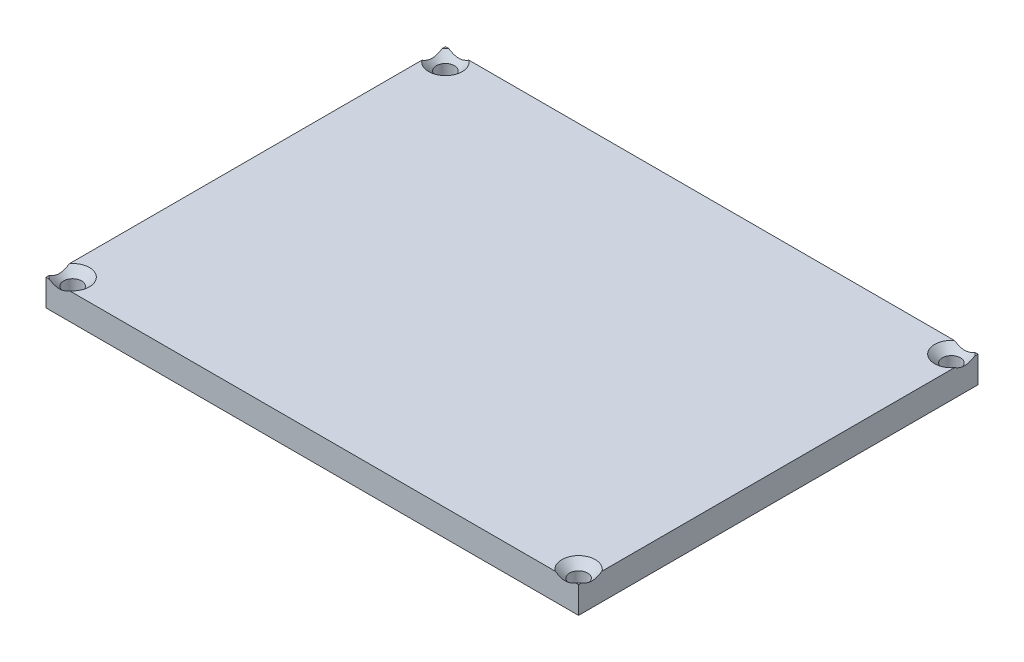
from build123d import *

# Parameters (mm, degrees)
SALIENTE_EXTRUIR1_DEPTH                     = 5
AVELLANADO_PARA_TORNILLO_CON_CABEZA_3_COUNT = 2
AVELLANADO_PARA_TORNILLO_CON_CABEZA_3_PITCH = 70
AVELLANADO_PARA_TORNILLO_CON_CABEZA_4_COUNT = 2
AVELLANADO_PARA_TORNILLO_CON_CABEZA_4_PITCH = 118.00423721205946
AVELLANADO_PARA_TORNILLO_CON_CABEZA_5_COUNT = 2
AVELLANADO_PARA_TORNILLO_CON_CABEZA_5_PITCH = 95
AVELLANADO_PARA_TORNILLO_CON_CABEZA_6_COUNT = 2
AVELLANADO_PARA_TORNILLO_CON_CABEZA_6_PITCH = 69.99999670760137
AVELLANADO_PARA_TORNILLO_CON_CABEZA_7_COUNT = 2
AVELLANADO_PARA_TORNILLO_CON_CABEZA_7_PITCH = 118.00424590243654
AVELLANADO_PARA_TORNILLO_CON_CABEZA_8_COUNT = 2
AVELLANADO_PARA_TORNILLO_CON_CABEZA_8_PITCH = 95.00001009358513


with BuildPart() as part:
    # Croquis1 → Saliente-Extruir1 (new body)
    with BuildSketch(Plane(origin=(0, 0, 0), x_dir=(1, 0, 0), z_dir=(0, 1, 0))):
        Polygon((-67.58389261744966, 18.71364653243848), (32.41610738255034, 18.71364653243848), (32.41610738255035, -56.28635346756151), (-67.58389261744965, -56.28635346756151), align=None)
    extrude(amount=SALIENTE_EXTRUIR1_DEPTH)

    # Croquis3 → Avellanado para tornillo con cabeza plana avellanada de M31 (revolve, cut)
    with BuildSketch(Plane(origin=(-65.08389261744965, 5, 53.78635346756151), x_dir=(0, 0, 1), z_dir=(1, 0, 0))):
        Polygon((0, 0), (-1.22e-15, 5.000000000000001), (1.6999999999999986, 5), (1.699999999999999, 1.4500000000000013), (3.15, 0), align=None)
    avellanado_para_tornillo_con_cabeza_plan = revolve(axis=Axis((-65.08389261744965, 11.34999999999999, 53.78635346756151), (0, -1, 0)), mode=Mode.SUBTRACT)

    # Avellanado para tornillo con cabeza  3: Avellanado para tornillo con cabeza plana avellanada de M31 ×2
    with Locations(*[(0, 0, -i * AVELLANADO_PARA_TORNILLO_CON_CABEZA_3_PITCH) for i in range(1, AVELLANADO_PARA_TORNILLO_CON_CABEZA_3_COUNT)]):
        add(avellanado_para_tornillo_con_cabeza_plan, mode=Mode.SUBTRACT)

    # Avellanado para tornillo con cabeza  4: Avellanado para tornillo con cabeza plana avellanada de M31 ×2
    with Locations(*[Vector(0.8050558373533679, 0, -0.5931990380498501) * (i * AVELLANADO_PARA_TORNILLO_CON_CABEZA_4_PITCH) for i in range(1, AVELLANADO_PARA_TORNILLO_CON_CABEZA_4_COUNT)]):
        add(avellanado_para_tornillo_con_cabeza_plan, mode=Mode.SUBTRACT)

    # Avellanado para tornillo con cabeza  5: Avellanado para tornillo con cabeza plana avellanada de M31 ×2
    with Locations(*[(i * AVELLANADO_PARA_TORNILLO_CON_CABEZA_5_PITCH, 0, 0) for i in range(1, AVELLANADO_PARA_TORNILLO_CON_CABEZA_5_COUNT)]):
        add(avellanado_para_tornillo_con_cabeza_plan, mode=Mode.SUBTRACT)

    # Avellanado para tornillo con cabeza  6: Avellanado para tornillo con cabeza plana avellanada de M31 ×2
    with Locations(*[(0, 0, -i * AVELLANADO_PARA_TORNILLO_CON_CABEZA_6_PITCH) for i in range(1, AVELLANADO_PARA_TORNILLO_CON_CABEZA_6_COUNT)]):
        add(avellanado_para_tornillo_con_cabeza_plan, mode=Mode.SUBTRACT)

    # Avellanado para tornillo con cabeza  7: Avellanado para tornillo con cabeza plana avellanada de M31 ×2
    with Locations(*[Vector(0.8050558705764262, 0, -0.5931989929614112) * (i * AVELLANADO_PARA_TORNILLO_CON_CABEZA_7_PITCH) for i in range(1, AVELLANADO_PARA_TORNILLO_CON_CABEZA_7_COUNT)]):
        add(avellanado_para_tornillo_con_cabeza_plan, mode=Mode.SUBTRACT)

    # Avellanado para tornillo con cabeza  8: Avellanado para tornillo con cabeza plana avellanada de M31 ×2
    with Locations(*[(i * AVELLANADO_PARA_TORNILLO_CON_CABEZA_8_PITCH, 0, 0) for i in range(1, AVELLANADO_PARA_TORNILLO_CON_CABEZA_8_COUNT)]):
        add(avellanado_para_tornillo_con_cabeza_plan, mode=Mode.SUBTRACT)


solid = part.part
